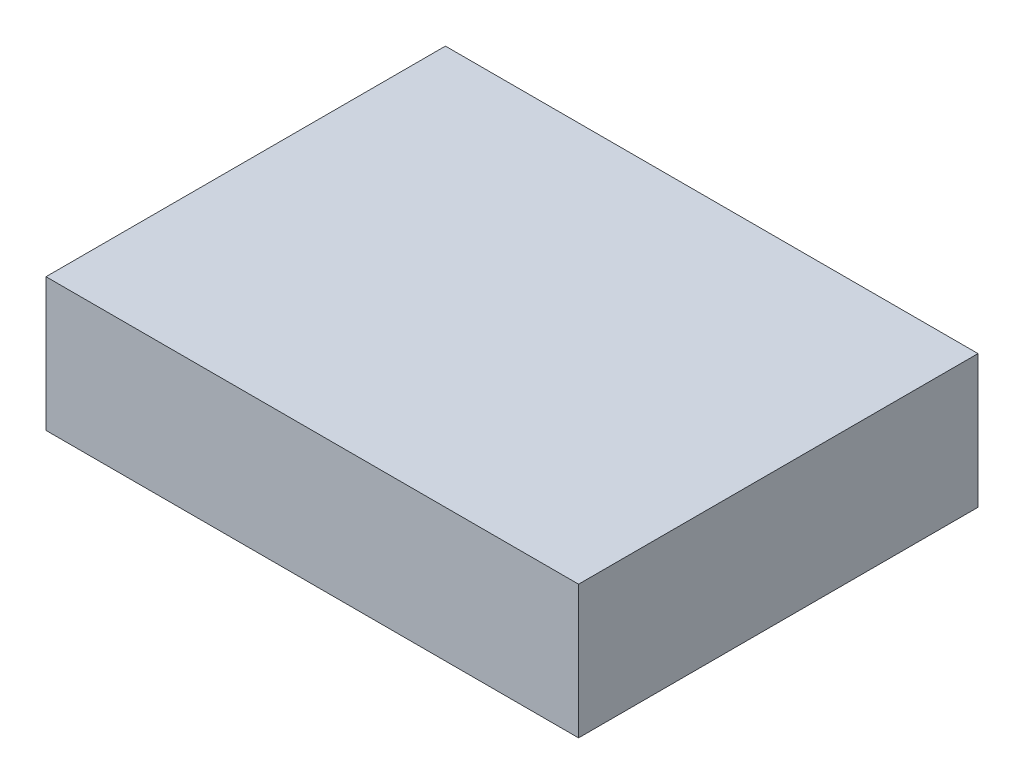
from build123d import *

# Parameters (mm, degrees)
SKETCH1_W           = 50.8
SKETCH1_H           = 38.1
BOSS_EXTRUDE1_DEPTH = 12.7


with BuildPart() as part:
    # Sketch1 → Boss-Extrude1 (new body)
    with BuildSketch(Plane(origin=(0, 0, 0), x_dir=(1, 0, 0), z_dir=(0, 1, 0))):
        Rectangle(SKETCH1_W, SKETCH1_H)
    extrude(amount=BOSS_EXTRUDE1_DEPTH)


solid = part.part
